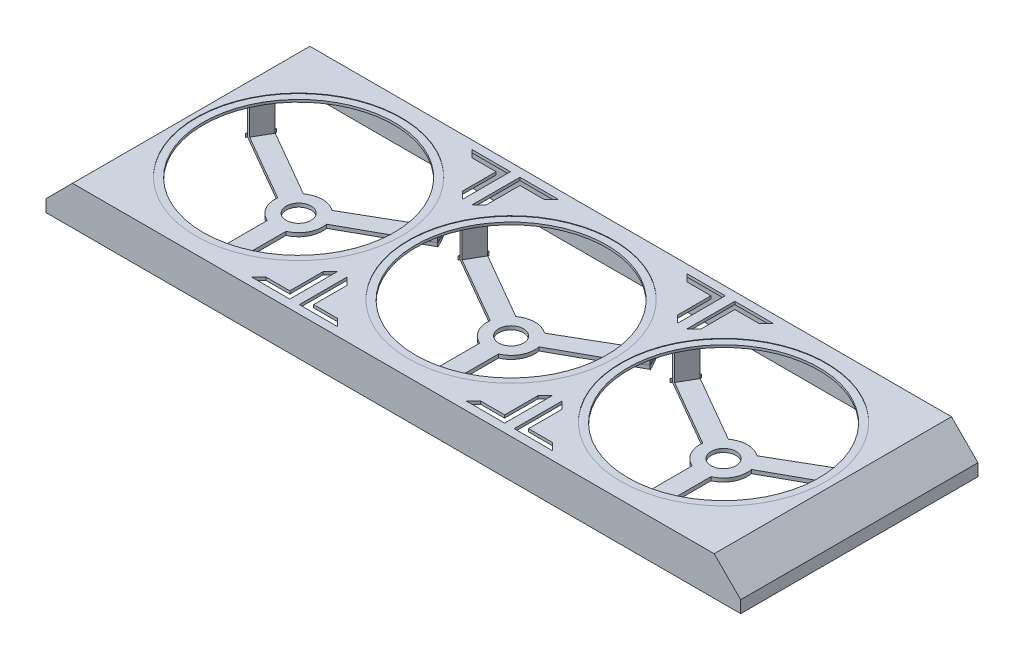
from build123d import *

# Parameters (mm, degrees)
BOSS_EXTRUDE1_DEPTH = 48.5
BOSS_EXTRUDE2_DEPTH = 1.2
SKETCH3_R           = 40
CUT_EXTRUDE1_DEPTH  = 1.2
CUT_EXTRUDE2_DEPTH  = 2
SKETCH5_R           = 43
CUT_EXTRUDE3_DEPTH  = 0.2
BOSS_EXTRUDE3_DEPTH = 12
SKETCH7_R           = 43.974076034
BOSS_EXTRUDE4_DEPTH = 1.5
SKETCH8_R           = 5.201754581
CUT_EXTRUDE5_DEPTH  = 1.5
LPATTERN1_COUNT     = 3
LPATTERN1_PITCH     = 89


with BuildPart() as part:
    # Sketch1 → Boss-Extrude1 (new, symmetric)
    with BuildSketch(Plane.XY):
        Polygon((134.381637017, 0), (-134.381637017, 0), (-145.5, -11.118362983), (-145.5, -16.2), (-144.3, -16.2), (-144.3, -11.615419258), (-133.884580742, -1.2), (133.884580742, -1.2), (144.3, -11.615419258), (144.3, -16.2), (145.5, -16.2), (145.5, -11.118362983), align=None)
    extrude(amount=BOSS_EXTRUDE1_DEPTH, both=True)

    # Sketch2 → Boss-Extrude2 (add)
    with BuildSketch(Plane.XY.offset(48.5)):
        Polygon((-144.3, -11.615419258), (-144.3, -16.2), (144.3, -16.2), (144.3, -11.615419258), (133.884580742, -1.2), (-133.884580742, -1.2), align=None)
        Polygon((134.381637017, 0), (-134.381637017, 0), (-145.5, -11.118362983), (-145.5, -16.2), (-144.3, -16.2), (-144.3, -11.615419258), (-133.884580742, -1.2), (133.884580742, -1.2), (144.3, -11.615419258), (144.3, -16.2), (145.5, -16.2), (145.5, -11.118362983), align=None)
    boss_extrude2 = extrude(amount=BOSS_EXTRUDE2_DEPTH)

    # Mirror1: Boss-Extrude2 across plane
    add(boss_extrude2.mirror(Plane.XY))

    # Sketch3 → Cut-Extrude1 (cut)
    with BuildSketch(Plane(origin=(0, 0, 0), x_dir=(1, 0, 0), z_dir=(0, 1, 0))):
        with Locations(Location((-89.381637017, 0, 0), (0, 0, 270))):
            Circle(SKETCH3_R)
        with Locations(Location((-0.381637017, 0, 0), (0, 0, 270))):
            Circle(SKETCH3_R)
        with Locations(Location((88.618362983, 0, 0), (0, 0, 270))):
            Circle(SKETCH3_R)
    extrude(amount=-CUT_EXTRUDE1_DEPTH, mode=Mode.SUBTRACT)

    # Sketch4 → Cut-Extrude2 (cut)
    with BuildSketch(Plane(origin=(0, 0, 0), x_dir=(1, 0, 0), z_dir=(0, 1, 0))):
        Polygon((27.072755505, 46.20633915), (43.118362983, 46.20633915), (43.118362983, 26.20633915), (40.118362983, 29.20633915), (40.118362983, 43.20633915), (30.072755505, 43.20633915), align=None)
        Polygon((-62.927244495, 46.20633915), (-46.881637017, 46.20633915), (-46.881637017, 26.20633915), (-49.881637017, 29.20633915), (-49.881637017, 43.20633915), (-59.927244495, 43.20633915), align=None)
        Polygon((-42.881637017, 26.20633915), (-39.881637017, 29.20633915), (-39.881637017, 43.20633915), (-29.83602954, 43.20633915), (-26.83602954, 46.20633915), (-42.881637017, 46.20633915), align=None)
        Polygon((47.118362983, 26.20633915), (50.118362983, 29.20633915), (50.118362983, 43.20633915), (60.16397046, 43.20633915), (63.16397046, 46.20633915), (47.118362983, 46.20633915), align=None)
        Polygon((47.118362983, -46.20633915), (47.118362983, -26.20633915), (50.118362983, -29.20633915), (50.118362983, -43.20633915), (60.16397046, -43.20633915), (63.16397046, -46.20633915), align=None)
        Polygon((30.072755505, -43.20633915), (27.072755505, -46.20633915), (43.118362983, -46.20633915), (43.118362983, -26.20633915), (40.118362983, -29.20633915), (40.118362983, -43.20633915), align=None)
        Polygon((-26.83602954, -46.20633915), (-42.881637017, -46.20633915), (-42.881637017, -26.20633915), (-39.881637017, -29.20633915), (-39.881637017, -43.20633915), (-29.83602954, -43.20633915), align=None)
        Polygon((-46.881637017, -26.20633915), (-49.881637017, -29.20633915), (-49.881637017, -43.20633915), (-59.927244495, -43.20633915), (-62.927244495, -46.20633915), (-46.881637017, -46.20633915), align=None)
    extrude(amount=-CUT_EXTRUDE2_DEPTH, mode=Mode.SUBTRACT)

    # Sketch5 → Cut-Extrude3 (cut)
    with BuildSketch(Plane(origin=(0, 0, 0), x_dir=(1, 0, 0), z_dir=(0, 1, 0))):
        with Locations(Location((-89.381637017, 0, 0), (0, 0, 270))):
            Circle(SKETCH5_R)
        with Locations(Location((-0.381637017, 0, 0), (0, 0, 270))):
            Circle(SKETCH5_R)
        with Locations(Location((88.618362983, 0, 0), (0, 0, 270))):
            Circle(SKETCH5_R)
    extrude(amount=-CUT_EXTRUDE3_DEPTH, mode=Mode.SUBTRACT)

    # Sketch6 → Boss-Extrude3 (add)
    with BuildSketch(Plane.XZ.offset(1.2)):
        with BuildLine():
            ThreePointArc((-93.313311985, 42.342443804), (-89.381637017, 42.524588362), (-85.449962049, 42.342443804))
            Line((-85.449962049, 42.342443804), (-85.449962049, 43.625211856))
            Line((-85.449962049, 43.625211856), (-93.313311985, 43.625211856))
            Line((-93.313311985, 43.625211856), (-93.313311985, 42.342443804))
        make_face()
        with BuildLine():
            Line((-85.449962049, 41.423964868), (-85.449962049, 42.342443804))
            ThreePointArc((-85.449962049, 42.342443804), (-89.381637017, 42.524588362), (-93.313311985, 42.342443804))
            Line((-93.313311985, 42.342443804), (-93.313311985, 41.423964868))
            Line((-93.313311985, 41.423964868), (-85.449962049, 41.423964868))
        make_face()
        with BuildLine():
            ThreePointArc((-128.017106494, -17.7662915), (-126.209010824, -21.262294181), (-124.085431526, -24.576152303))
            Line((-124.085431526, -24.576152303), (-123.290005434, -24.116912835))
            Line((-123.290005434, -24.116912835), (-127.221680402, -17.307052032))
            Line((-127.221680402, -17.307052032), (-128.017106494, -17.7662915))
        make_face()
        with BuildLine():
            Line((-125.196341246, -25.217536329), (-124.085431526, -24.576152303))
            ThreePointArc((-124.085431526, -24.576152303), (-126.209010824, -21.262294181), (-128.017106494, -17.7662915))
            Line((-128.017106494, -17.7662915), (-129.128016214, -18.407675526))
            Line((-129.128016214, -18.407675526), (-125.196341246, -25.217536329))
        make_face()
        with BuildLine():
            ThreePointArc((-50.746167541, -17.7662915), (-52.55426321, -21.262294181), (-54.677842509, -24.576152303))
            Line((-54.677842509, -24.576152303), (-53.566932789, -25.217536329))
            Line((-53.566932789, -25.217536329), (-49.635257821, -18.407675526))
            Line((-49.635257821, -18.407675526), (-50.746167541, -17.7662915))
        make_face()
        with BuildLine():
            Line((-51.541593632, -17.307052032), (-55.4732686, -24.116912835))
            Line((-55.4732686, -24.116912835), (-54.677842509, -24.576152303))
            ThreePointArc((-54.677842509, -24.576152303), (-52.55426321, -21.262294181), (-50.746167541, -17.7662915))
            Line((-50.746167541, -17.7662915), (-51.541593632, -17.307052032))
        make_face()
    boss_extrude3 = extrude(amount=BOSS_EXTRUDE3_DEPTH)

    # Sketch7 → Boss-Extrude4 (add)
    with BuildSketch(Plane.XZ.offset(13.2)):
        with Locations(Location((-89.381637017, 0, 0), (0, 0, 270))):
            Circle(SKETCH7_R)
    boss_extrude4 = extrude(amount=BOSS_EXTRUDE4_DEPTH)

    # Sketch8 → Cut-Extrude5 (cut)
    with BuildSketch(Plane(origin=(0, -13.2, 0), x_dir=(1, 0, 0), z_dir=(0, 1, 0))):
        with Locations(Location((-89.381637017, 0, 0), (0, 0, 270))):
            Circle(SKETCH8_R)
        with BuildLine():
            Line((-125.196341246, 25.217536329), (-95.378616181, 8.002264736))
            ThreePointArc((-95.378616181, 8.002264736), (-89.381637017, 10), (-83.384657854, 8.002264736))
            Line((-83.384657854, 8.002264736), (-53.566932789, 25.217536329))
            ThreePointArc((-53.566932789, 25.217536329), (-89.381637017, 48.0726531), (-125.196341246, 25.217536329))
        make_face()
        with BuildLine():
            Line((-129.128016214, 18.407675526), (-99.310291149, 1.192403933))
            ThreePointArc((-99.310291149, 1.192403933), (-98.041891055, -5), (-93.313311985, -9.19466867))
            Line((-93.313311985, -9.19466867), (-93.313311985, -43.625211856))
            ThreePointArc((-93.313311985, -43.625211856), (-132.523670412, -24.908064594), (-129.128016214, 18.407675526))
        make_face()
        with BuildLine():
            Line((-49.635257821, 18.407675526), (-79.557126293, 1.865204822))
            ThreePointArc((-79.557126293, 1.865204822), (-80.556198693, -4.702301393), (-85.449962049, -9.19466867))
            Line((-85.449962049, -9.19466867), (-85.449962049, -43.625211856))
            ThreePointArc((-85.449962049, -43.625211856), (-44.690338045, -25.802533492), (-49.635257821, 18.407675526))
        make_face()
    cut_extrude5 = extrude(amount=-CUT_EXTRUDE5_DEPTH, mode=Mode.SUBTRACT)

    # LPattern1: Boss-Extrude3, Boss-Extrude4, Cut-Extrude5 ×3
    with Locations(*[(i * LPATTERN1_PITCH, 0, 0) for i in range(1, LPATTERN1_COUNT)]):
        add(boss_extrude3)
        add(boss_extrude4)
        add(cut_extrude5, mode=Mode.SUBTRACT)


solid = part.part
